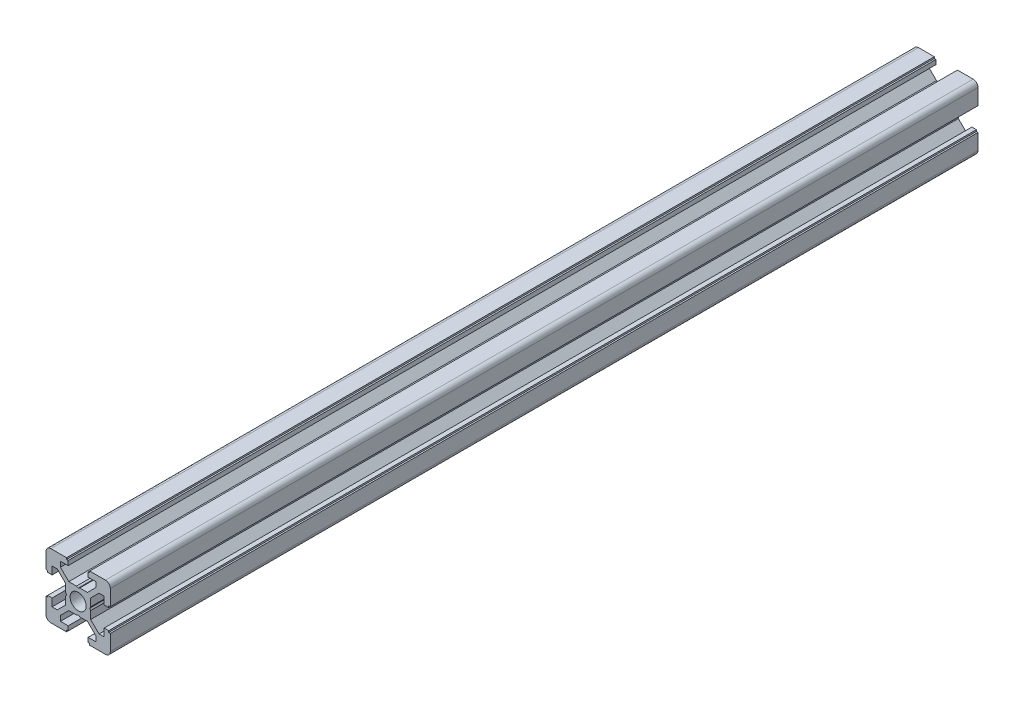
from build123d import *

# Parameters (mm, degrees)
MODEL_R         = 2.5
EXTRUDE_1_DEPTH = 270


with BuildPart() as part:
    # Model → 凸台-拉伸1 (new body)
    with BuildSketch(Plane.XY):
        with BuildLine():
            Line((-3.9, 0.519615242), (-3.6, 0))
            Line((-3.6, 0), (-3.9, -0.519615242))
            Line((-3.9, -0.519615242), (-3.9, -2.910050506))
            Line((-3.9, -2.910050506), (-6.489949494, -5.5))
            Line((-6.489949494, -5.5), (-8.1, -5.5))
            Line((-8.1, -5.5), (-8.1, -3.1))
            Line((-8.1, -3.1), (-9.5, -3.1))
            Line((-9.5, -3.1), (-9.5, -3.6))
            Line((-9.5, -3.6), (-10, -3.6))
            Line((-10, -3.6), (-10, -8.5))
            ThreePointArc((-10, -8.5), (-9.560660172, -9.560660172), (-8.5, -10))
            Line((-8.5, -10), (-3.6, -10))
            Line((-3.6, -10), (-3.6, -9.5))
            Line((-3.6, -9.5), (-3.1, -9.5))
            Line((-3.1, -9.5), (-3.1, -8.1))
            Line((-3.1, -8.1), (-5.5, -8.1))
            Line((-5.5, -8.1), (-5.5, -6.489949494))
            Line((-5.5, -6.489949494), (-2.910050506, -3.9))
            Line((-2.910050506, -3.9), (-0.519615242, -3.9))
            Line((-0.519615242, -3.9), (0, -3.6))
            Line((0, -3.6), (0.519615242, -3.9))
            Line((0.519615242, -3.9), (2.910050506, -3.9))
            Line((2.910050506, -3.9), (5.5, -6.489949494))
            Line((5.5, -6.489949494), (5.5, -8.1))
            Line((5.5, -8.1), (3.1, -8.1))
            Line((3.1, -8.1), (3.1, -9.5))
            Line((3.1, -9.5), (3.6, -9.5))
            Line((3.6, -9.5), (3.6, -10))
            Line((3.6, -10), (8.5, -10))
            ThreePointArc((8.5, -10), (9.560660172, -9.560660172), (10, -8.5))
            Line((10, -8.5), (10, -3.6))
            Line((10, -3.6), (9.5, -3.6))
            Line((9.5, -3.6), (9.5, -3.1))
            Line((9.5, -3.1), (8.1, -3.1))
            Line((8.1, -3.1), (8.1, -5.5))
            Line((8.1, -5.5), (6.489949494, -5.5))
            Line((6.489949494, -5.5), (3.9, -2.910050506))
            Line((3.9, -2.910050506), (3.9, -0.519615242))
            Line((3.9, -0.519615242), (3.6, 0))
            Line((3.6, 0), (3.9, 0.519615242))
            Line((3.9, 0.519615242), (3.9, 2.910050506))
            Line((3.9, 2.910050506), (6.489949494, 5.5))
            Line((6.489949494, 5.5), (8.1, 5.5))
            Line((8.1, 5.5), (8.1, 3.1))
            Line((8.1, 3.1), (9.5, 3.1))
            Line((9.5, 3.1), (9.5, 3.6))
            Line((9.5, 3.6), (10, 3.6))
            Line((10, 3.6), (10, 8.5))
            ThreePointArc((10, 8.5), (9.560660172, 9.560660172), (8.5, 10))
            Line((8.5, 10), (3.6, 10))
            Line((3.6, 10), (3.6, 9.5))
            Line((3.6, 9.5), (3.1, 9.5))
            Line((3.1, 9.5), (3.1, 8.1))
            Line((3.1, 8.1), (5.5, 8.1))
            Line((5.5, 8.1), (5.5, 6.489949494))
            Line((5.5, 6.489949494), (2.910050506, 3.9))
            Line((2.910050506, 3.9), (0.519615242, 3.9))
            Line((0.519615242, 3.9), (0, 3.6))
            Line((0, 3.6), (-0.519615242, 3.9))
            Line((-0.519615242, 3.9), (-2.910050506, 3.9))
            Line((-2.910050506, 3.9), (-5.5, 6.489949494))
            Line((-5.5, 6.489949494), (-5.5, 8.1))
            Line((-5.5, 8.1), (-3.1, 8.1))
            Line((-3.1, 8.1), (-3.1, 9.5))
            Line((-3.1, 9.5), (-3.6, 9.5))
            Line((-3.6, 9.5), (-3.6, 10))
            Line((-3.6, 10), (-8.5, 10))
            ThreePointArc((-8.5, 10), (-9.560660172, 9.560660172), (-10, 8.5))
            Line((-10, 8.5), (-10, 3.6))
            Line((-10, 3.6), (-9.5, 3.6))
            Line((-9.5, 3.6), (-9.5, 3.1))
            Line((-9.5, 3.1), (-8.1, 3.1))
            Line((-8.1, 3.1), (-8.1, 5.5))
            Line((-8.1, 5.5), (-6.489949494, 5.5))
            Line((-6.489949494, 5.5), (-3.9, 2.910050506))
            Line((-3.9, 2.910050506), (-3.9, 0.519615242))
        make_face()
        Circle(MODEL_R, mode=Mode.SUBTRACT)
    extrude(amount=EXTRUDE_1_DEPTH)


solid = part.part
